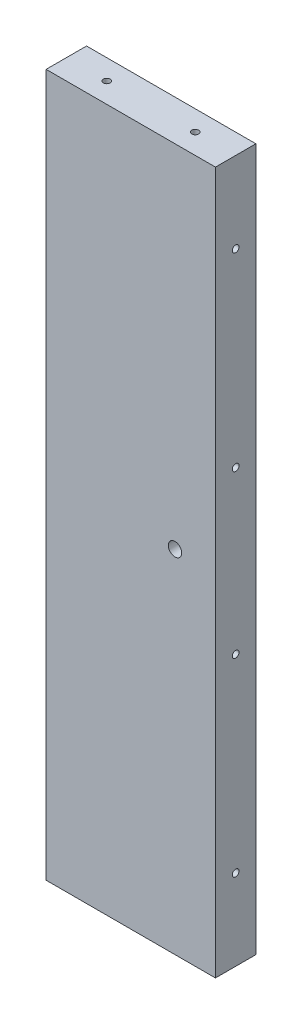
from build123d import *

# Parameters (mm, degrees)
SKETCH1_W                   = 79.793650928
SKETCH1_H                   = 330.949999988
BOSS_EXTRUDE1_DEPTH         = 19.05
F_1_4_0_25_DIAMETER_HOLE1_D = 6.35
HOLE6_D                     = 3.175
HOLE6_DEPTH                 = 38.1
HOLE6_CSINK_D               = 10.16
HOLE6_CSINK_ANGLE           = 82
HOLE6_TIP                   = 0.953866233
HOLE7_D                     = 3.175
HOLE7_DEPTH                 = 39.686133767
HOLE7_CSINK_D               = 10.16
HOLE7_CSINK_ANGLE           = 82
HOLE7_TIP                   = 0.953866233


with BuildPart() as part:
    # Sketch1 → Boss-Extrude1 (new body)
    with BuildSketch(Plane.XY):
        with Locations((249.249792645, -72.024999997)):
            Rectangle(SKETCH1_W, SKETCH1_H)
    extrude(amount=BOSS_EXTRUDE1_DEPTH)

    # 1/4 (0.25) Diameter Hole1 (through all)
    with Locations(Plane(origin=(0, 0, 0), x_dir=(-1, 0, 0), z_dir=(0, 0, -1))):
        with Locations((-270.096618017, -72.024999997)):
            Hole(F_1_4_0_25_DIAMETER_HOLE1_D / 2)

    # Hole6
    with Locations(Plane(origin=(308.196618109, -72.024999997, 609.909770337), x_dir=(0, -1, 0), z_dir=(1, 0, 0))):
        with Locations((81.549999997, 717.438633361), (-81.549999997, 717.438633361), (-81.549999997, 641.659770441), (-81.549999997, 793.217496281), (-174.999999994, 705.391438111), (-174.999999994, 329.112770337), (-174.999999994, 579.965215507), (-174.999999994, 454.538992941), (-174.999999994, 517.252104224), (-127.374999994, 600.384770441), (-38.1, 600.384770441), (-127.374999994, 376.737770337), (-38.1, 376.737770337), (38.1, 376.737770337), (127.374999994, 376.737770337), (38.1, 600.384770441), (127.374999994, 600.384770441), (174.999999994, 517.252104224), (174.999999994, 454.538992941), (174.999999994, 579.965215507), (174.999999994, 329.112770337), (174.999999994, 705.391438111), (81.549999997, 793.217496281), (81.549999997, 641.659770441)):
            CounterSinkHole(HOLE6_D / 2, HOLE6_CSINK_D / 2, depth=HOLE6_DEPTH, counter_sink_angle=HOLE6_CSINK_ANGLE)
            with Locations((0, 0, -(HOLE6_DEPTH + HOLE6_TIP / 2))):  # 118° drill point
                Cone(0, HOLE6_D / 2, HOLE6_TIP, mode=Mode.SUBTRACT)

    # Hole7
    with Locations(Plane(origin=(-181.039434513, 112.499999997, 386.262770337), x_dir=(0.9271838545667855, -1.3196841813264566e-15, -0.37460659341591657), z_dir=(0, 1, 0))):
        with Locations((546.331381686, 147.924742102), (34.861843518, 129.510688231), (398.711186007, 72.427013068), (25.409302346, 25.4), (393.709302346, 25.4), (604.536477781, 403.287242286), (643.194157759, 387.668525745), (520.756836983, 195.925354764), (559.414516961, 180.306638222), (507.673701708, 163.543458643)):
            CounterSinkHole(HOLE7_D / 2, HOLE7_CSINK_D / 2, depth=HOLE7_DEPTH, counter_sink_angle=HOLE7_CSINK_ANGLE)
            with Locations((0, 0, -(HOLE7_DEPTH + HOLE7_TIP / 2))):  # 118° drill point
                Cone(0, HOLE7_D / 2, HOLE7_TIP, mode=Mode.SUBTRACT)


solid = part.part
